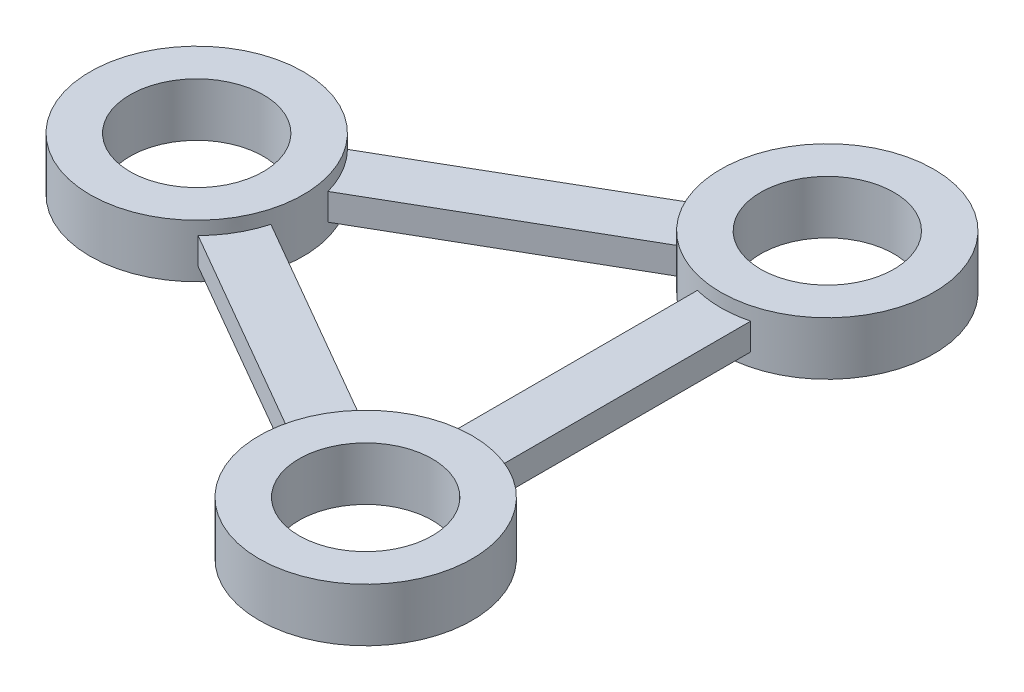
from build123d import *

# Parameters (mm, degrees)
Y_KSEKLIK_EKSTR_ZYON4_DEPTH        = 10
Y_KSEKLIK_EKSTR_ZYON4_DEPTH_BACK   = 10
IZIM1_R                            = 40
IZIM1_R_2                          = 25
Y_KSEKLIK_EKSTR_ZYON4_2_DEPTH      = 10
Y_KSEKLIK_EKSTR_ZYON4_2_DEPTH_BACK = 10
Y_KSEKLIK_EKSTR_ZYON4_3_DEPTH      = 10
Y_KSEKLIK_EKSTR_ZYON4_3_DEPTH_BACK = 10
IZIM1_R_3                          = 40.003689591
Y_KSEKLIK_EKSTR_ZYON5_DEPTH        = 5
Y_KSEKLIK_EKSTR_ZYON5_DEPTH_BACK   = 5


with BuildPart() as part:
    # Çizim1 → Yükseklik-Ekstrüzyon4 (new, two sides: drawn at the far end of the back side and taken through both)
    with BuildSketch(Plane(origin=(0, 0, 0), x_dir=(1, 0, 0), z_dir=(0, 1, 0)).offset(-Y_KSEKLIK_EKSTR_ZYON4_DEPTH_BACK)):
        with Locations((0, 86.6)):
            Circle(IZIM1_R)
        with Locations((0, 86.6)):
            Circle(IZIM1_R_2, mode=Mode.SUBTRACT)
    extrude(amount=Y_KSEKLIK_EKSTR_ZYON4_DEPTH + Y_KSEKLIK_EKSTR_ZYON4_DEPTH_BACK)



with BuildPart() as body_2:
    # Çizim1 → Y_kseklik-Ekstr_zyon4 2 (new, two sides: drawn at the far end of the back side and taken through both)
    with BuildSketch(Plane(origin=(0, 0, 0), x_dir=(1, 0, 0), z_dir=(0, 1, 0)).offset(-Y_KSEKLIK_EKSTR_ZYON4_2_DEPTH_BACK)):
        with Locations((0, -86.6)):
            Circle(IZIM1_R)
        with Locations((0, -86.6)):
            Circle(IZIM1_R_2, mode=Mode.SUBTRACT)
    extrude(amount=Y_KSEKLIK_EKSTR_ZYON4_2_DEPTH + Y_KSEKLIK_EKSTR_ZYON4_2_DEPTH_BACK)


with BuildPart() as body_3:
    # Çizim1 → Y_kseklik-Ekstr_zyon4 3 (new, two sides: drawn at the far end of the back side and taken through both)
    with BuildSketch(Plane(origin=(0, 0, 0), x_dir=(1, 0, 0), z_dir=(0, 1, 0)).offset(-Y_KSEKLIK_EKSTR_ZYON4_3_DEPTH_BACK)):
        with Locations((-150, 0)):
            Circle(IZIM1_R_3)
        with Locations((-150, 0)):
            Circle(IZIM1_R_2, mode=Mode.SUBTRACT)
    extrude(amount=Y_KSEKLIK_EKSTR_ZYON4_3_DEPTH + Y_KSEKLIK_EKSTR_ZYON4_3_DEPTH_BACK)


with BuildPart() as part_1:
    add(part.part)

    add(body_2.part)  # Yükseklik-Ekstrüzyon5 merges body 2

    add(body_3.part)  # Yükseklik-Ekstrüzyon5 merges body 3
    # Çizim1<6> → Yükseklik-Ekstrüzyon5 (add, two sides: drawn at the far end of the back side and taken through both)
    with BuildSketch(Plane(origin=(0, 0, 0), x_dir=(1, 0, 0), z_dir=(0, 1, 0)).offset(-Y_KSEKLIK_EKSTR_ZYON5_DEPTH_BACK)):
        with BuildLine():
            ThreePointArc((10, 47.870166538), (0, 46.6), (-10, 47.870166538))
            Line((-10, 47.870166538), (-10, -47.870166538))
            ThreePointArc((-10, -47.870166538), (0, -46.6), (10, -47.870166538))
            Line((10, -47.870166538), (10, 47.870166538))
        make_face()
        with BuildLine():
            Line((-111.455544285, 10.706078394), (-28.541375636, 58.575191761))
            ThreePointArc((-28.541375636, 58.575191761), (-34.641270188, 66.600440011), (-38.54115563, 75.895826855))
            Line((-38.54115563, 75.895826855), (-121.45532428, 28.026713488))
            ThreePointArc((-121.45532428, 28.026713488), (-115.355534509, 20.001404744), (-111.455544285, 10.706078394))
        make_face()
        with BuildLine():
            ThreePointArc((-38.54115563, -75.895826855), (-34.641270188, -66.600440011), (-28.541375636, -58.575191761))
            Line((-28.541375636, -58.575191761), (-111.455544285, -10.706078394))
            ThreePointArc((-111.455544285, -10.706078394), (-115.355534509, -20.001404744), (-121.45532428, -28.026713488))
            Line((-121.45532428, -28.026713488), (-38.54115563, -75.895826855))
        make_face()
    extrude(amount=Y_KSEKLIK_EKSTR_ZYON5_DEPTH + Y_KSEKLIK_EKSTR_ZYON5_DEPTH_BACK)


solid = part_1.part
